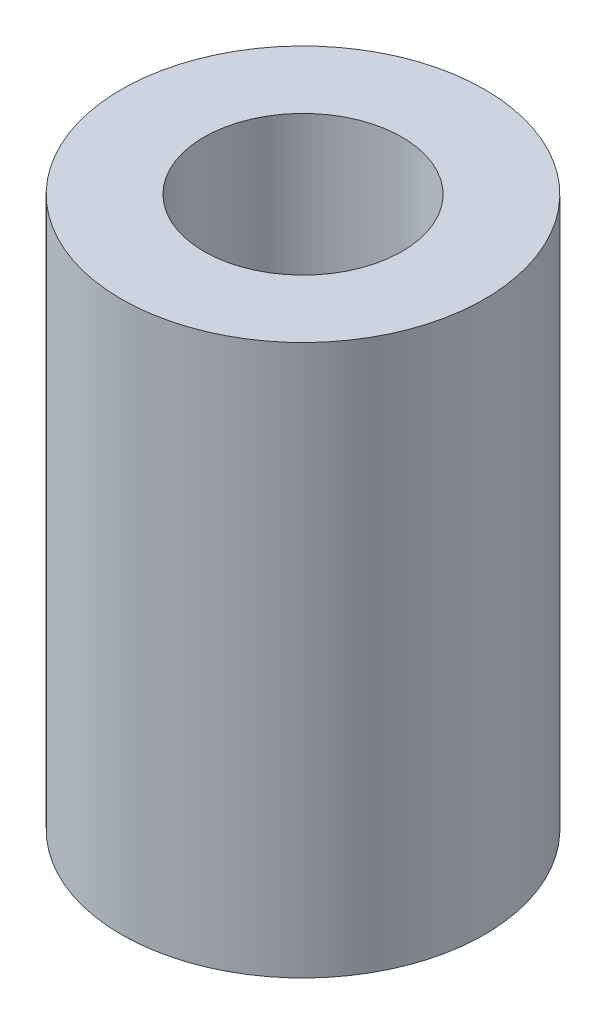
from build123d import *

# Parameters (mm, degrees)
SKETCH1_R           = 8.382
SKETCH1_R_2         = 4.572
BOSS_EXTRUDE1_DEPTH = 25.4


with BuildPart() as part:
    # Sketch1 → Boss-Extrude1 (new body)
    with BuildSketch(Plane(origin=(0, 0, 0), x_dir=(1, 0, 0), z_dir=(0, 1, 0))):
        with Locations(Location((0, 0, 0), (0, 0, 270))):
            Circle(SKETCH1_R)
        with Locations(Location((0, 0, 0), (0, 0, 270))):
            Circle(SKETCH1_R_2, mode=Mode.SUBTRACT)
    extrude(amount=BOSS_EXTRUDE1_DEPTH)


solid = part.part
